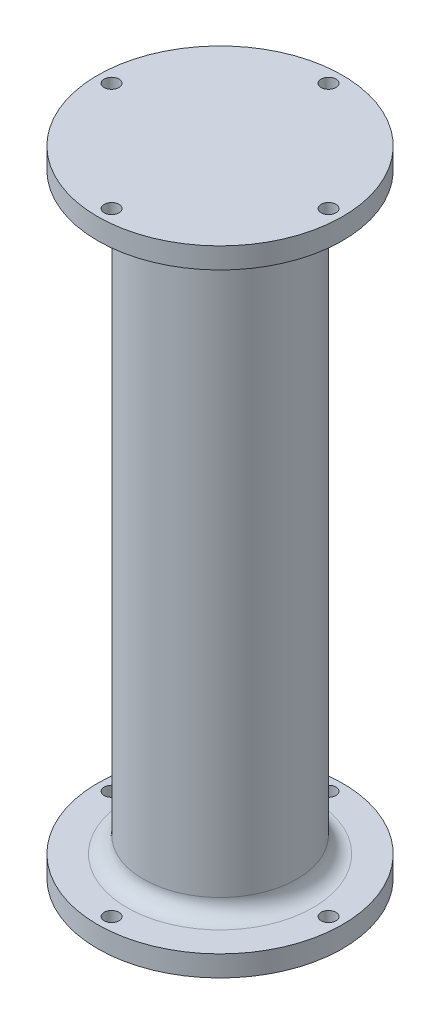
from build123d import *

# Parameters (mm, degrees)
SKETCH1_R           = 74.5
BOSS_EXTRUDE1_DEPTH = 385.699
SKETCH2_W           = 27.8577878
SKETCH2_H           = 360.299
SKETCH3_R           = 4.499991
CUT_EXTRUDE1_DEPTH  = 400.830237227
CIRPATTERN1_COUNT   = 4
FILLET1_R           = 10


with BuildPart() as part:
    # Sketch1 → Boss-Extrude1 (new body)
    with BuildSketch(Plane(origin=(0, 0, 0), x_dir=(1, 0, 0), z_dir=(0, 1, 0))):
        with Locations(Location((0, 0, 0), (0, 0, 270))):
            Circle(SKETCH1_R)
    extrude(amount=BOSS_EXTRUDE1_DEPTH)

    # Sketch2 → Cut-Revolve4 (revolve, cut)
    with BuildSketch(Plane.XY, mode=Mode.PRIVATE) as cut_revolve4_sk:
        with Locations((-60.5711061, 192.8495)):
            Rectangle(SKETCH2_W, SKETCH2_H)
    revolve(cut_revolve4_sk.sketch.rotate(Axis((0, 385.699, 0), (0, -1, 0)), 270), axis=Axis((0, 385.699, 0), (0, -1, 0)), mode=Mode.SUBTRACT)

    # Sketch3 → Cut-Extrude1 (cut, through all)
    with BuildSketch(Plane.XZ):
        with Locations(Location((0, 66.000122, 0), (0, 0, 270))):
            Circle(SKETCH3_R)
    cut_extrude1 = extrude(amount=-CUT_EXTRUDE1_DEPTH, mode=Mode.SUBTRACT)

    # CirPattern1: Cut-Extrude1 ×4 about axis
    cirpattern1_axis = Axis((0, 0, 0), (0, 1, 0))
    for i in range(1, CIRPATTERN1_COUNT):
        add(cut_extrude1.rotate(cirpattern1_axis, i * 360 / CIRPATTERN1_COUNT), mode=Mode.SUBTRACT)

    # Fillet1
    fillet1_edges = [part.edges().sort_by_distance(p)[0] for p in [
        (0, 12.7, -46.6422122),
        (0, 372.999, -46.6422122),
    ]]
    fillet(fillet1_edges, radius=FILLET1_R)


solid = part.part
